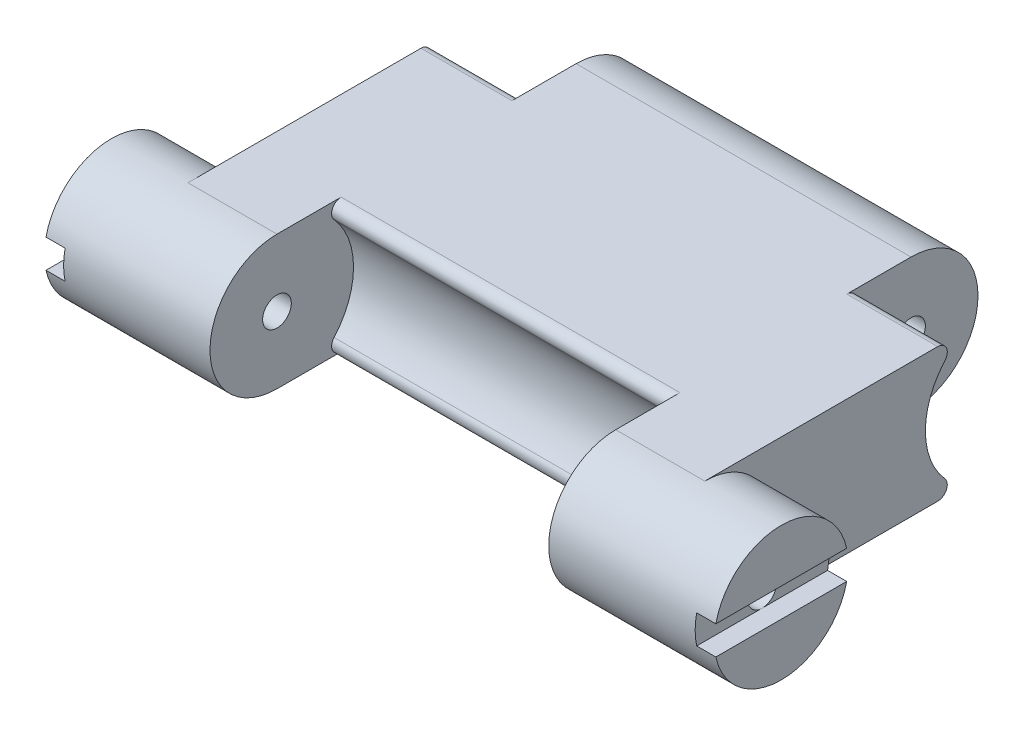
from build123d import *

# Parameters (mm, degrees)
EXTRUDE_1_DEPTH     = 17.5
SKETCH_3_W          = 24
SKETCH_3_H          = 9
SKETCH_3_R          = 3.5
CUT_EXTRUDE_1_DEPTH = 4
SKETCH_6_R          = 4
CUT_EXTRUDE_2_DEPTH = 8.85
SKETCH_7_R          = 4
CUT_EXTRUDE_3_DEPTH = 4.75
SKETCH_9_W          = 7.2
SKETCH_9_H          = 1.5
CUT_EXTRUDE_5_DEPTH = 1
FILLET_1_R          = 0.5
SKETCH_8_R          = 0.75
CUT_EXTRUDE_4_DEPTH = 38.428601697


with BuildPart() as part:
    # Эскиз1 → Бобышка-Вытянуть1 (new, symmetric)
    with BuildSketch(Plane(origin=(0, 0, 0), x_dir=(0, 0, -1), z_dir=(1, 0, 0))):
        with BuildLine():
            Line((-7.765, 7), (7.765, 7))
            ThreePointArc((7.765, 7), (11.265, 3.5), (7.765, 0))
            Line((7.765, 0), (-7.765, 0))
            ThreePointArc((-7.765, 0), (-11.265, 3.5), (-7.765, 7))
        make_face()
    extrude(amount=EXTRUDE_1_DEPTH, both=True)

    # Эскиз3 → Вырез-Вытянуть1 (cut)
    with BuildSketch(Plane(origin=(17.5, 0, 0), x_dir=(0, 0, -1), z_dir=(1, 0, 0))):
        with Locations((0, 3.5)):
            Rectangle(SKETCH_3_W, SKETCH_3_H)
        with Locations(Location((-7.765, 3.5, 0), (0, 0, 90))):
            Circle(SKETCH_3_R, mode=Mode.SUBTRACT)
    cut_extrude_1 = extrude(amount=-CUT_EXTRUDE_1_DEPTH, mode=Mode.SUBTRACT)

    # Зеркальное отражение1: Вырез-Вытянуть1 across plane
    add(cut_extrude_1.mirror(Plane(origin=(0, 0, 0), x_dir=(0, 0, 1), z_dir=(1, 0, 0))), mode=Mode.SUBTRACT)

    # Эскиз6 → Вырез-Вытянуть2 (cut, symmetric)
    with BuildSketch(Plane(origin=(0, 0, 0), x_dir=(0, 0, -1), z_dir=(1, 0, 0))):
        with Locations((-7.765, 3.5)):
            Circle(SKETCH_6_R)
    extrude(amount=CUT_EXTRUDE_2_DEPTH, both=True, mode=Mode.SUBTRACT)

    # Эскиз7 → Вырез-Вытянуть3 (cut)
    with BuildSketch(Plane(origin=(13.5, 0, 0), x_dir=(0, 0, -1), z_dir=(1, 0, 0))):
        with Locations((7.765, 3.5)):
            Circle(SKETCH_7_R)
    cut_extrude_3 = extrude(amount=-CUT_EXTRUDE_3_DEPTH, mode=Mode.SUBTRACT)

    # Эскиз9 → Вырез-Вытянуть5 (cut)
    with BuildSketch(Plane(origin=(17.5, 0, 0), x_dir=(0, 0, -1), z_dir=(1, 0, 0))):
        with Locations((-7.765, 3.5)):
            Rectangle(SKETCH_9_W, SKETCH_9_H)
    cut_extrude_5 = extrude(amount=-CUT_EXTRUDE_5_DEPTH, mode=Mode.SUBTRACT)

    # Зеркальное отражение2: Вырез-Вытянуть3, Вырез-Вытянуть5 across plane
    add(cut_extrude_3.mirror(Plane(origin=(0, 0, 0), x_dir=(0, 0, 1), z_dir=(1, 0, 0))), mode=Mode.SUBTRACT)
    add(cut_extrude_5.mirror(Plane(origin=(0, 0, 0), x_dir=(0, 0, 1), z_dir=(1, 0, 0))), mode=Mode.SUBTRACT)

    # Скругление1
    fillet_1_edges = [part.edges().sort_by_distance(p)[0] for p in [
        (-11.125, 0, -5.828508327),
        (-11.125, 7, -5.828508327),
        (0, 7, 5.828508327),
        (0, 0, 5.828508327),
        (11.125, 0, -5.828508327),
        (11.125, 7, -5.828508327),
    ]]
    fillet(fillet_1_edges, radius=FILLET_1_R)

    # Эскиз8 → Вырез-Вытянуть4 (cut, through all)
    with BuildSketch(Plane(origin=(17.5, 0, 0), x_dir=(0, 0, -1), z_dir=(1, 0, 0))):
        with Locations((-7.765, 3.5)):
            Circle(SKETCH_8_R)
        with Locations((7.765, 3.5)):
            Circle(SKETCH_8_R)
    extrude(amount=-CUT_EXTRUDE_4_DEPTH, mode=Mode.SUBTRACT)


solid = part.part
